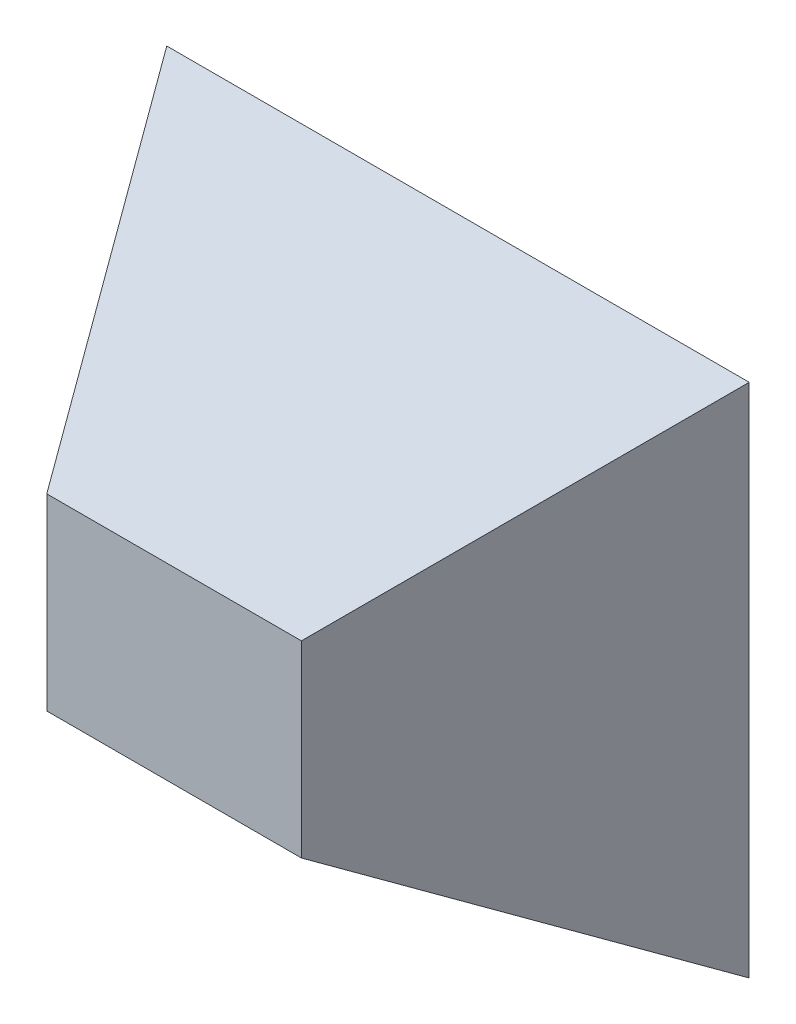
from build123d import *

# Parameters (mm, degrees)
SKETCH1_W           = 350
SKETCH1_H           = 310
BOSS_EXTRUDE1_DEPTH = 170.6
BOSS_EXTRUDE1_TAPER = 30
SHELL1_T            = -1.67


with BuildPart() as part:
    # Sketch1 → Boss-Extrude1 (new body)
    with BuildSketch(Plane.XY):
        Rectangle(SKETCH1_W, SKETCH1_H)
    extrude(amount=BOSS_EXTRUDE1_DEPTH, taper=BOSS_EXTRUDE1_TAPER)

    # Shell1
    shell1_openings = [part.faces().sort_by_distance(p)[0] for p in [
        (0, 0, 0),
    ]]
    offset(amount=SHELL1_T, openings=shell1_openings, kind=Kind.INTERSECTION)


solid = part.part
